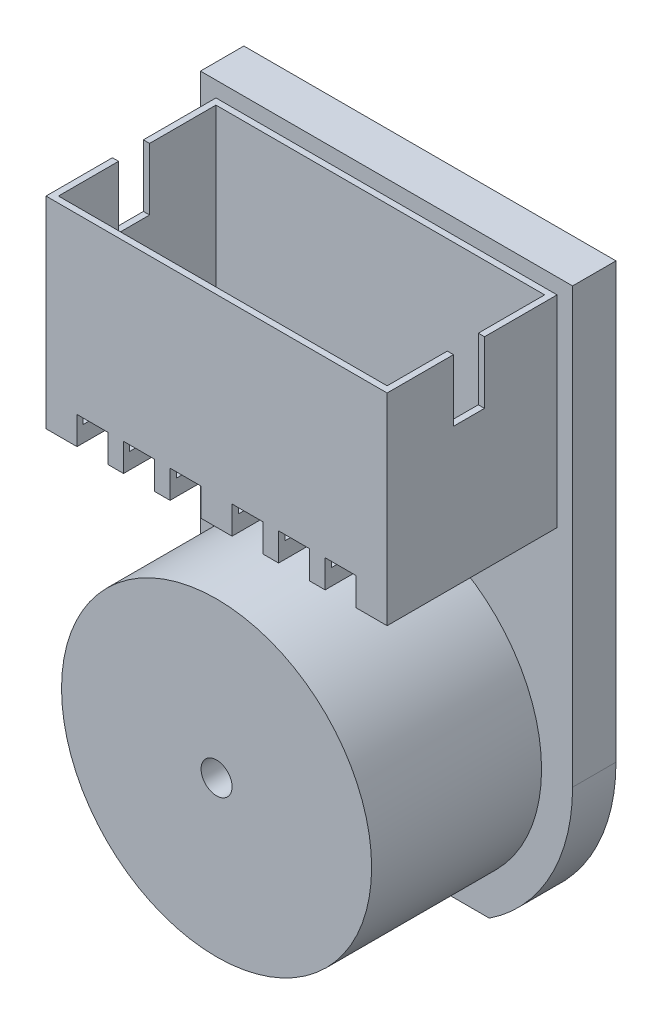
from build123d import *

# Parameters (mm, degrees)
BOSS_EXTRUDE2_DEPTH = 1.4
SKETCH3_W           = 11
SKETCH3_H           = 6.5
BOSS_EXTRUDE4_DEPTH = 5.48
SKETCH4_W           = 10.6
SKETCH4_H           = 5.08
CUT_EXTRUDE1_DEPTH  = 5.98
SKETCH6_W           = 1
SKETCH6_H           = 2
CUT_EXTRUDE2_DEPTH  = 11.98
SKETCH7_W           = 1
SKETCH7_H           = 0.9
CUT_EXTRUDE3_DEPTH  = 1
SKETCH8_R           = 5
BOSS_EXTRUDE5_DEPTH = 5.48
SKETCH9_R           = 0.5
CUT_EXTRUDE4_DEPTH  = 5.48
SKETCH10_R          = 1
BOSS_EXTRUDE6_DEPTH = 1


with BuildPart() as part:
    # Sketch1 → Boss-Extrude2 (new body)
    with BuildSketch(Plane.XY):
        with BuildLine():
            Line((3.31662479, -5), (-3.31662479, -5))
            ThreePointArc((-3.31662479, -5), (-5.286764074, -2.837274331), (-6, 0))
            Line((-6, 0), (-6, 14))
            Line((-6, 14), (6, 14))
            Line((6, 14), (6, 0))
            ThreePointArc((6, 0), (5.286764074, -2.837274331), (3.31662479, -5))
        make_face()
    extrude(amount=BOSS_EXTRUDE2_DEPTH)

    # Sketch3 → Boss-Extrude4 (add)
    with BuildSketch(Plane.XY.offset(1.4)):
        with Locations((0, 10.25)):
            Rectangle(SKETCH3_W, SKETCH3_H)
    extrude(amount=BOSS_EXTRUDE4_DEPTH)

    # Sketch4 → Cut-Extrude1 (cut)
    with BuildSketch(Plane(origin=(0, 13.5, 0), x_dir=(1, 0, 0), z_dir=(0, 1, 0))):
        with Locations((0, -4.14)):
            Rectangle(SKETCH4_W, SKETCH4_H)
    extrude(amount=-CUT_EXTRUDE1_DEPTH, mode=Mode.SUBTRACT)

    # Sketch6 → Cut-Extrude2 (cut)
    with BuildSketch(Plane(origin=(5.5, 0, 0), x_dir=(0, 0, -1), z_dir=(1, 0, 0))):
        with Locations((-4.24, 12.5)):
            Rectangle(SKETCH6_W, SKETCH6_H)
    extrude(amount=-CUT_EXTRUDE2_DEPTH, mode=Mode.SUBTRACT)

    # Sketch7 → Cut-Extrude3 (cut)
    with BuildSketch(Plane.XY.offset(6.88)):
        with Locations((2.5, 7.45)):
            Rectangle(SKETCH7_W, SKETCH7_H)
        with Locations((1, 7.45)):
            Rectangle(SKETCH7_W, SKETCH7_H)
        with Locations((-1, 7.45)):
            Rectangle(SKETCH7_W, SKETCH7_H)
        with Locations((-2.5, 7.45)):
            Rectangle(SKETCH7_W, SKETCH7_H)
        with Locations((-4, 7.45)):
            Rectangle(SKETCH7_W, SKETCH7_H)
        with Locations((4, 7.45)):
            Rectangle(SKETCH7_W, SKETCH7_H)
    extrude(amount=-CUT_EXTRUDE3_DEPTH, mode=Mode.SUBTRACT)

    # Sketch8 → Boss-Extrude5 (add)
    with BuildSketch(Plane.XY.offset(1.4)):
        with Locations(Location((0, 0, 0), (0, 0, 270))):
            Circle(SKETCH8_R)
    extrude(amount=BOSS_EXTRUDE5_DEPTH)

    # Sketch9 → Cut-Extrude4 (cut)
    with BuildSketch(Plane.XY.offset(6.88)):
        Circle(SKETCH9_R)
    extrude(amount=-CUT_EXTRUDE4_DEPTH, mode=Mode.SUBTRACT)

    # Sketch10 → Boss-Extrude6 (add)
    with BuildSketch(Plane(origin=(0, 0, 0), x_dir=(-1, 0, 0), z_dir=(0, 0, -1))):
        Circle(SKETCH10_R)
    extrude(amount=BOSS_EXTRUDE6_DEPTH)


solid = part.part
